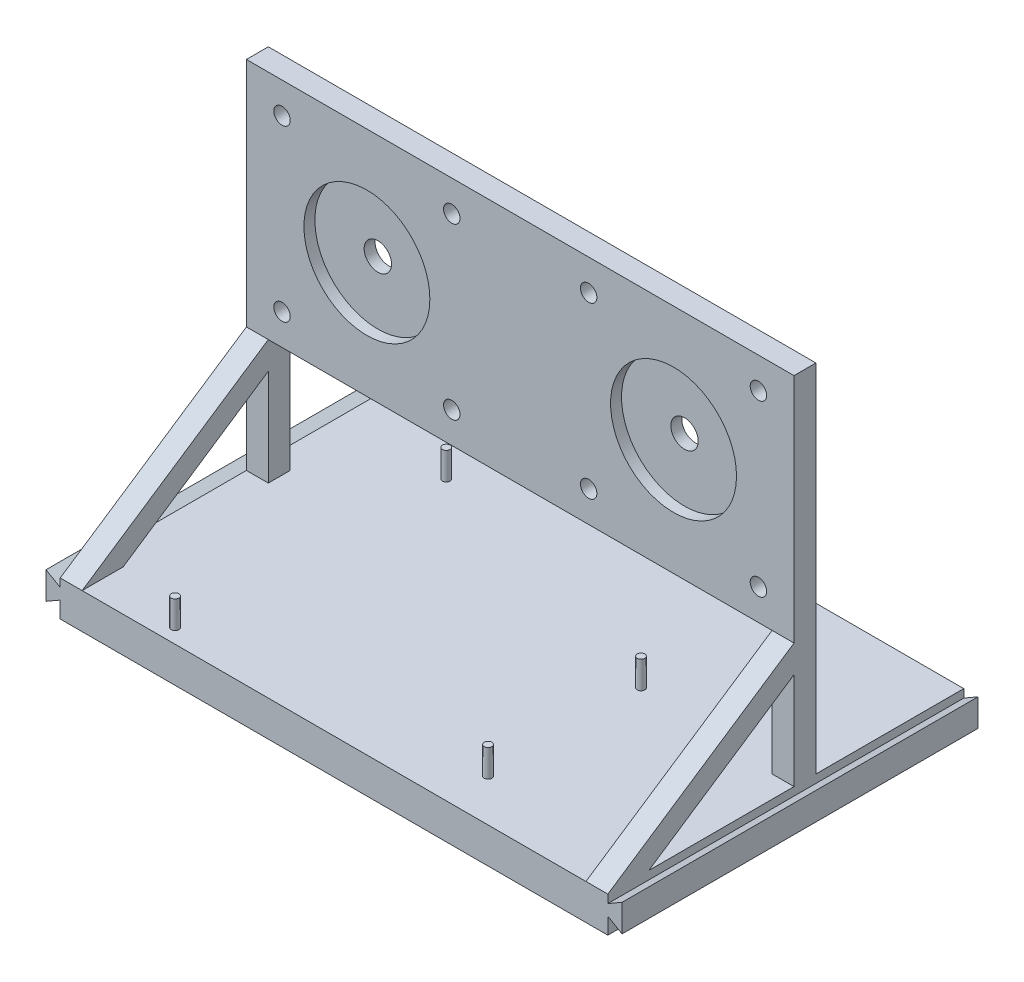
from build123d import *

# Parameters (mm, degrees)
EXTRUDE_7_DEPTH     = 65
SKETCH_6_W          = 4
SKETCH_6_H          = 4
EXTRUDE_10_DEPTH    = 65
SKETCH_7_W          = 4
SKETCH_7_H          = 42.3
EXTRUDE_11_DEPTH    = 92
SKETCH_8_R          = 11.5
CUT_EXTRUDE_2_DEPTH = 2
SKETCH_10_R         = 2.5
CUT_EXTRUDE_3_DEPTH = 2
SKETCH_11_R         = 1.5
CUT_EXTRUDE_6_DEPTH = 4
EXTRUDE_13_DEPTH    = 2
SKETCH_14_R         = 0.7
EXTRUDE_14_DEPTH    = 5


with BuildPart() as part:
    # 草图1 → 凸台-拉伸7 (new body)
    with BuildSketch(Plane.XY):
        Polygon((-50, -29), (-50, -30.5), (-52.598076211, -29), (-52.598076211, -34), (-50, -32.5), (-50, -35.5), (50, -35.5), (50, -32.5), (52.598076211, -34), (52.598076211, -29), (50, -30.5), (50, -29), align=None)
    extrude(amount=EXTRUDE_7_DEPTH)

    # 草图6 → 凸台-拉伸10 (add)
    with BuildSketch(Plane(origin=(0, -29, 0), x_dir=(1, 0, 0), z_dir=(0, 1, 0))):
        with Locations((-48, -29)):
            Rectangle(SKETCH_6_W, SKETCH_6_H)
    extrude_10 = extrude(amount=EXTRUDE_10_DEPTH)

    # 镜向1: 凸台-拉伸10 across plane
    add(extrude_10.mirror(Plane(origin=(0, 0, 0), x_dir=(0, 0, 1), z_dir=(1, 0, 0))))

    # 草图7 → 凸台-拉伸11 (add)
    with BuildSketch(Plane(origin=(-46, 0, 0), x_dir=(0, 0, -1), z_dir=(1, 0, 0))):
        with Locations((-29, 14.85)):
            Rectangle(SKETCH_7_W, SKETCH_7_H)
    extrude(amount=EXTRUDE_11_DEPTH)

    # 草图8 → 切除-拉伸2 (cut)
    with BuildSketch(Plane.XY.offset(31)):
        with Locations((-28, 14.85)):
            Circle(SKETCH_8_R)
        with Locations((28, 14.85)):
            Circle(SKETCH_8_R)
    extrude(amount=-CUT_EXTRUDE_2_DEPTH, mode=Mode.SUBTRACT)

    # 草图10 → 切除-拉伸3 (cut)
    with BuildSketch(Plane.XY.offset(29)):
        with Locations((-28, 14.85)):
            Circle(SKETCH_10_R)
        with Locations((28, 14.85)):
            Circle(SKETCH_10_R)
    extrude(amount=-CUT_EXTRUDE_3_DEPTH, mode=Mode.SUBTRACT)

    # 草图11 → 切除-拉伸6 (cut)
    with BuildSketch(Plane.XY.offset(31)):
        with Locations((-43.5, 30.35)):
            Circle(SKETCH_11_R)
        with Locations((-12.5, 30.35)):
            Circle(SKETCH_11_R)
        with Locations((-43.5, -0.65)):
            Circle(SKETCH_11_R)
        with Locations((-12.5, -0.65)):
            Circle(SKETCH_11_R)
        with Locations((12.5, 30.35)):
            Circle(SKETCH_11_R)
        with Locations((43.5, 30.35)):
            Circle(SKETCH_11_R)
        with Locations((12.5, -0.65)):
            Circle(SKETCH_11_R)
        with Locations((43.5, -0.65)):
            Circle(SKETCH_11_R)
    extrude(amount=-CUT_EXTRUDE_6_DEPTH, mode=Mode.SUBTRACT)

    # 草图13 → 凸台-拉伸13 (add, symmetric)
    with BuildSketch(Plane(origin=(48, 0, 0), x_dir=(0, 0, -1), z_dir=(1, 0, 0))):
        Polygon((-65, -29), (-31, -6.3), (-31, -11.3), (-57.511013216, -29), align=None)
    extrude_13 = extrude(amount=EXTRUDE_13_DEPTH, both=True)

    # 镜向3: 凸台-拉伸13 across plane
    add(extrude_13.mirror(Plane(origin=(0, 0, 0), x_dir=(0, 0, 1), z_dir=(1, 0, 0))))

    # 草图14 → 凸台-拉伸14 (add)
    with BuildSketch(Plane(origin=(0, -29, 0), x_dir=(1, 0, 0), z_dir=(0, 1, 0))):
        with Locations(Location((-30.407474137, -14.090366943, 0), (0, 0, 180))):
            Circle(SKETCH_14_R)
        with Locations(Location((-31.677474137, -62.350366943, 0), (0, 0, 180))):
            Circle(SKETCH_14_R)
        with Locations(Location((20.392525863, -29.330366943, 0), (0, 0, 180))):
            Circle(SKETCH_14_R)
        with Locations(Location((20.392525863, -57.270366943, 0), (0, 0, 180))):
            Circle(SKETCH_14_R)
    extrude(amount=EXTRUDE_14_DEPTH)


solid = part.part
